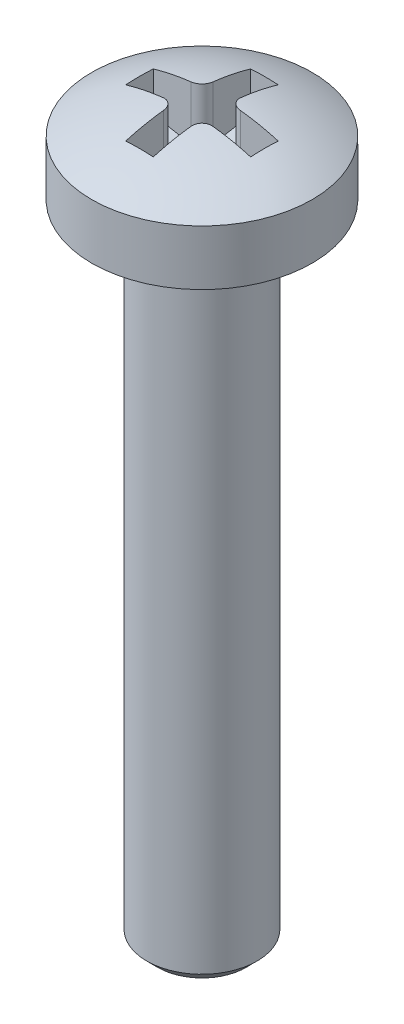
from build123d import *

# Parameters (mm, degrees)
CUT_EXTRUDE1_REACH      = 58.014
CUT_EXTRUDE1_END_RADIUS = 12.75
CUT_EXTRUDE1_START      = 20
FILLET1_R               = 0.6
CHAMFER1_SIZE           = 0.6


with BuildPart() as part:
    # Sketch1 → Revolve1 (revolve)
    with BuildSketch(Plane.XY, mode=Mode.PRIVATE) as revolve1_sk:
        with BuildLine():
            Line((0, 0), (0, 4.6))
            ThreePointArc((0, 4.6), (3.104834939, 4.193131022), (6, 3))
            Line((6, 3), (6, 0))
            Line((6, 0), (3, 0))
            Line((3, 0), (3, -35))
            Line((3, -35), (0, -35))
            Line((0, -35), (0, 0))
        make_face()
    revolve(revolve1_sk.sketch.rotate(Axis((0, 4.6, 0), (0, -1, 0)), 90), axis=Axis((0, 4.6, 0), (0, -1, 0)))

    # Cut-Extrude1: up to this sphere (the profile starts inside it)
    cut_extrude1_end = Location((0, 14.25, 0)) * Sphere(CUT_EXTRUDE1_END_RADIUS, mode=Mode.PRIVATE)
    # Sketch4 → Cut-Extrude1 (cut, up to the surface)
    with BuildSketch(Plane(origin=(0, 0, 0), x_dir=(1, 0, 0), z_dir=(0, 1, 0)).offset(CUT_EXTRUDE1_START), mode=Mode.PRIVATE) as cut_extrude1_sk1:
        Polygon((-0.75, -0.75), (-0.75, -3.4), (0.75, -3.4), (0.75, -0.75), (3.4, -0.75), (3.4, 0.75), (0.75, 0.75), (0.75, 3.4), (-0.75, 3.4), (-0.75, 0.75), (-3.4, 0.75), (-3.4, -0.75), align=None)
    cut_extrude1_tool1 = extrude(cut_extrude1_sk1.sketch, amount=-CUT_EXTRUDE1_REACH, mode=Mode.PRIVATE) & cut_extrude1_end
    add(cut_extrude1_tool1.solids().sort_by_distance((0, 20, 0))[0], mode=Mode.SUBTRACT)

    # Fillet1
    fillet1_edges = [part.edges().sort_by_distance(p)[0] for p in [
        (0.75, 3.048711486, 0.75),
        (-0.75, 3.048711486, 0.75),
        (-0.75, 3.048711486, -0.75),
        (0.75, 3.048711486, -0.75),
    ]]
    fillet(fillet1_edges, radius=FILLET1_R)

    # Chamfer1
    chamfer1_edges = [part.edges().sort_by_distance(p)[0] for p in [
        (0, -35, -3),
    ]]
    chamfer(chamfer1_edges, length=CHAMFER1_SIZE)


solid = part.part
